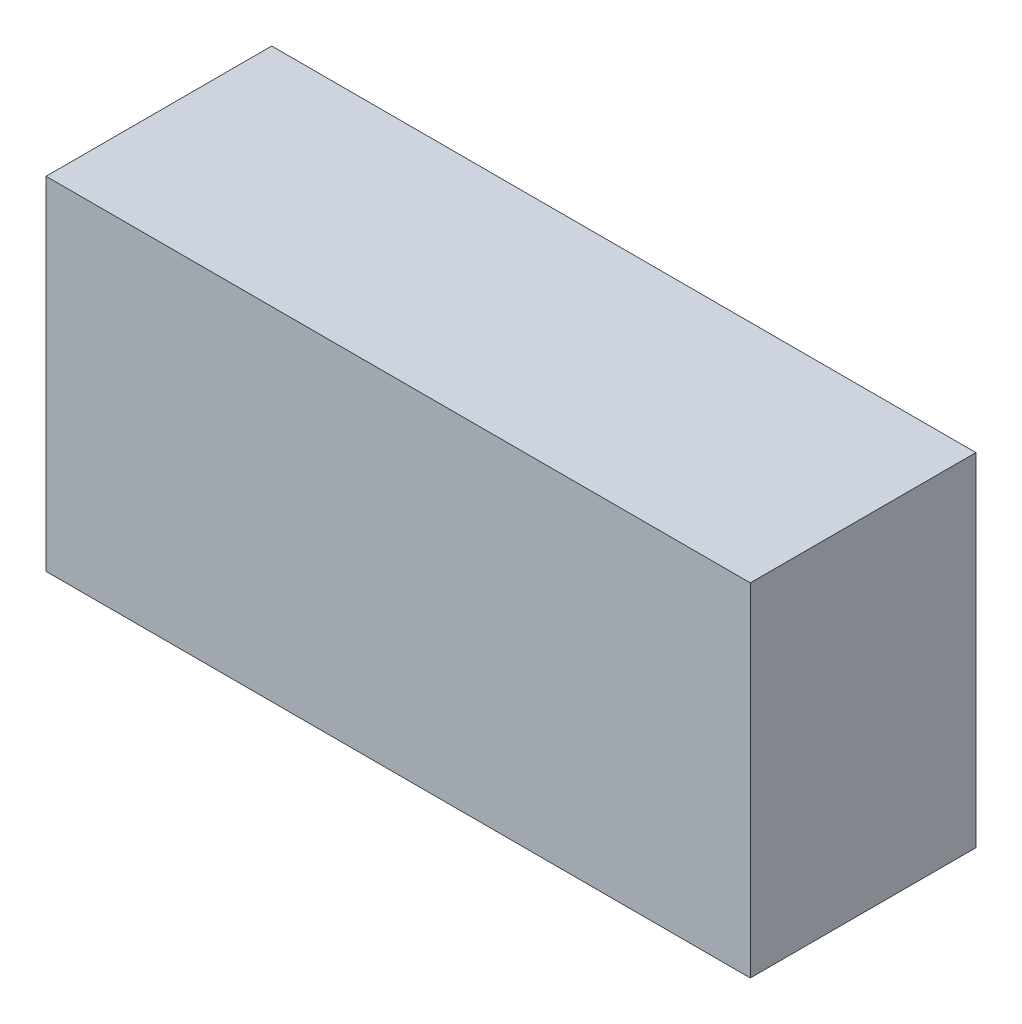
from build123d import *

# Parameters (mm, degrees)
SKETCH2_W           = 72.136
SKETCH2_H           = 23.114
BOSS_EXTRUDE1_DEPTH = 35.052


with BuildPart() as part:
    # Sketch2 → Boss-Extrude1 (new body)
    with BuildSketch(Plane(origin=(0, 0, 0), x_dir=(1, 0, 0), z_dir=(0, 1, 0))):
        with Locations((36.068, 11.557)):
            Rectangle(SKETCH2_W, SKETCH2_H)
    extrude(amount=BOSS_EXTRUDE1_DEPTH)


solid = part.part
